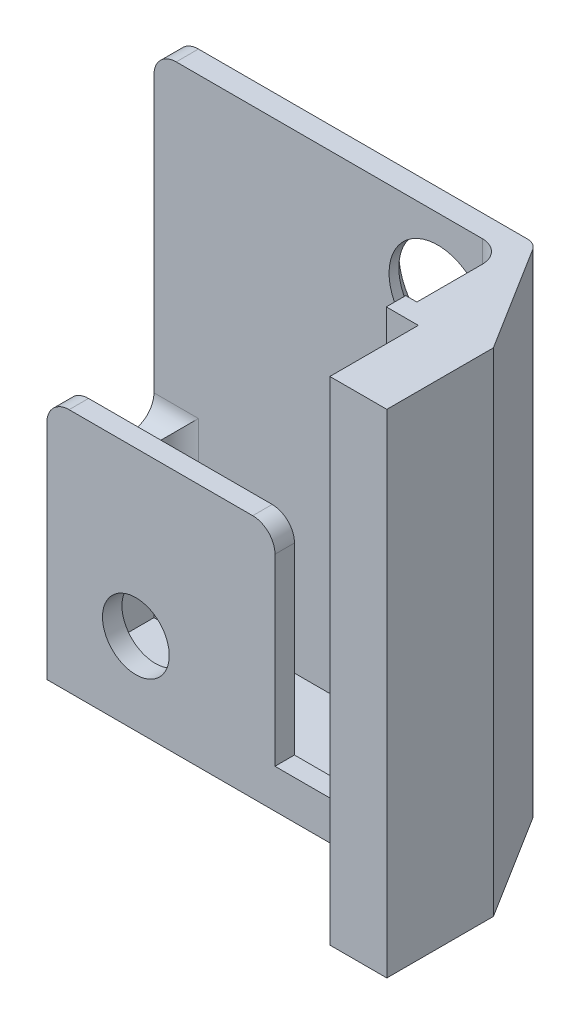
from build123d import *

# Parameters (mm, degrees)
BOSS_EXTRUDE1_DEPTH                             = 15.4
CUT_EXTRUDE2_REACH                              = 25.918
SKETCH3_W                                       = 7.5
SKETCH3_H                                       = 11.5
BOSS_EXTRUDE3_REACH                             = 25.918
SKETCH4_W                                       = 0.8
SKETCH4_H                                       = 6.2
SKETCH4_W_2                                     = 2.8
SKETCH4_H_2                                     = 17.7
SKETCH10_W                                      = 4
SKETCH10_H                                      = 0.7
CUT_EXTRUDE4_DEPTH                              = 16.3
BOSS_EXTRUDE4_DEPTH                             = 0.8
CSK_FOR_M2_FLAT_HEAD_MACHINE_SCREW3_D           = 2.4
CSK_FOR_M2_FLAT_HEAD_MACHINE_SCREW3_CSINK_D     = 4.4
CSK_FOR_M2_FLAT_HEAD_MACHINE_SCREW3_CSINK_ANGLE = 90
MOVE_FACE1_BY                                   = 0.6
SKETCH14_W                                      = 8.2
SKETCH14_H                                      = 8.3
CUT_EXTRUDE6_DEPTH                              = 0.7
SKETCH3_2_W                                     = 7.5
SKETCH3_2_H                                     = 11.5
BOSS_EXTRUDE6_DEPTH                             = 0.8
FILLET3_R                                       = 0.8
CHAMFER1_SIZE                                   = 2.5
CHAMFER1_SIZE2                                  = 4
SKETCH12_W                                      = 2.0475
SKETCH12_H                                      = 3.18
BOSS_EXTRUDE5_DEPTH                             = 17.7
FILLET5_R                                       = 0.5
SKETCH11_R                                      = 1.75
CUT_EXTRUDE5_DEPTH                              = 25.492262043
CUT_EXTRUDE5_DIRECTION_2_REACH                  = 26.492


with BuildPart() as part:
    # Sketch2 → Boss-Extrude1 (new body)
    with BuildSketch(Plane(origin=(0, 0, 0), x_dir=(0, 0, -1), z_dir=(1, 0, 0))):
        Polygon((0, 0), (-4.65, 0), (-4.65, 17.7), (-3.85, 17.7), (-3.85, 0.8), (-0.7, 0.8), (-0.7, 17.7), (0, 17.7), align=None)
    extrude(amount=BOSS_EXTRUDE1_DEPTH)

    # Sketch3 → Cut-Extrude2 (cut, up to next)
    with BuildSketch(Plane.XY.offset(4.65), mode=Mode.PRIVATE) as cut_extrude2_sk1:
        with Locations((3.75, 11.95)):
            Rectangle(SKETCH3_W, SKETCH3_H)
    cut_extrude2_tool1 = extrude(cut_extrude2_sk1.sketch, amount=-CUT_EXTRUDE2_REACH, mode=Mode.PRIVATE) & part.part
    add(cut_extrude2_tool1.solids().sort_by_distance((3.75, 11.95, 4.65))[0], mode=Mode.SUBTRACT)

    # Sketch4 → Boss-Extrude3 (add, up to next)
    with BuildSketch(Plane.XY.offset(4.65), mode=Mode.PRIVATE) as boss_extrude3_sk1:
        with Locations((0.4, 3.1)):
            Rectangle(SKETCH4_W, SKETCH4_H)
    boss_extrude3_tool1 = extrude(boss_extrude3_sk1.sketch, amount=-BOSS_EXTRUDE3_REACH, mode=Mode.PRIVATE) - part.part
    # Sketch4 → Boss-Extrude3 (add, up to next)
    with BuildSketch(Plane.XY.offset(4.65), mode=Mode.PRIVATE) as boss_extrude3_sk2:
        with Locations((14, 8.85)):
            Rectangle(SKETCH4_W_2, SKETCH4_H_2)
    boss_extrude3_tool2 = extrude(boss_extrude3_sk2.sketch, amount=-BOSS_EXTRUDE3_REACH, mode=Mode.PRIVATE) - part.part
    add(boss_extrude3_tool1.solids().sort_by_distance((0.4, 3.1, 4.65))[0])
    add(boss_extrude3_tool2.solids().sort_by_distance((14, 8.85, 4.65))[0])

    # Sketch10 → Cut-Extrude4 (cut)
    with BuildSketch(Plane(origin=(0, 17.7, 0), x_dir=(1, 0, 0), z_dir=(0, 1, 0))):
        with Locations((10.2, -0.35)):
            Rectangle(SKETCH10_W, SKETCH10_H)
    extrude(amount=-CUT_EXTRUDE4_DEPTH, mode=Mode.SUBTRACT)

    # Sketch6 → Boss-Extrude4 (add)
    with BuildSketch(Plane(origin=(0, 0, 3.85), x_dir=(-1, 0, 0), z_dir=(0, 0, -1))):
        with BuildLine():
            Line((-0.8, 0.8), (-5.05, 0.8))
            Line((-5.05, 0.8), (-5.05, 2.95))
            ThreePointArc((-5.05, 2.95), (-4.508147545, 4.258147545), (-3.2, 4.8))
            Line((-3.2, 4.8), (-0.8, 4.8))
            Line((-0.8, 4.8), (-0.8, 0.8))
        make_face()
    extrude(amount=BOSS_EXTRUDE4_DEPTH)

    # CSK for M2 Flat Head Machine Screw3 (through all)
    with Locations(Plane(origin=(10.2, 14.95, 4.65), x_dir=(0, 1, 0), z_dir=(0, 0, 1))):
        with Locations((0, 0), (-12, 7)):
            CounterSinkHole(CSK_FOR_M2_FLAT_HEAD_MACHINE_SCREW3_D / 2, CSK_FOR_M2_FLAT_HEAD_MACHINE_SCREW3_CSINK_D / 2, counter_sink_angle=CSK_FOR_M2_FLAT_HEAD_MACHINE_SCREW3_CSINK_ANGLE)

    # Move Face1: a face moved inward by 0.6
    extrude(part.faces().sort_by_distance((4.1, 17.7, 0.35))[0], amount=MOVE_FACE1_BY, dir=(0, -1, 0), mode=Mode.SUBTRACT)

    # Sketch14 → Cut-Extrude6 (cut)
    with BuildSketch(Plane(origin=(0, 0, 0), x_dir=(-1, 0, 0), z_dir=(0, 0, -1))):
        with Locations((-4.1, 12.95)):
            Rectangle(SKETCH14_W, SKETCH14_H)
    extrude(amount=-CUT_EXTRUDE6_DEPTH, mode=Mode.SUBTRACT)

    # Sketch3<2> → Boss-Extrude6 (add)
    with BuildSketch(Plane.XY.offset(4.65)):
        with Locations((3.75, 11.95)):
            Rectangle(SKETCH3_2_W, SKETCH3_2_H)
    extrude(amount=-BOSS_EXTRUDE6_DEPTH)

    # Fillet3
    fillet3_edges = [part.edges().sort_by_distance(p)[0] for p in [
        (0.8, 5.5, 3.85),
        (0, 8.8, 0.35),
        (8.2, 8.8, 0.35),
        (0, 17.7, 4.25),
        (0.4, 6.2, 3.85),
        (0.4, 6.2, 0.7),
        (12.6, 9.25, 3.85),
    ]]
    fillet(fillet3_edges, radius=FILLET3_R)

    # Chamfer1
    chamfer1_edges = [part.edges().sort_by_distance(p)[0] for p in [
        (15.4, 8.85, 4.65),
    ]]
    chamfer1_side = [part.faces().sort_by_distance(p)[0] for p in [
        (7.829915164, 8.832514614, 4.65),
    ]]
    chamfer(chamfer1_edges, length=CHAMFER1_SIZE, length2=CHAMFER1_SIZE2, reference=chamfer1_side[0])

    # Sketch12 → Boss-Extrude5 (add)
    with BuildSketch(Plane(origin=(0, 17.7, 0), x_dir=(1, 0, 0), z_dir=(0, 1, 0))):
        with Locations((14.37625, 1.59)):
            Rectangle(SKETCH12_W, SKETCH12_H)
    extrude(amount=-BOSS_EXTRUDE5_DEPTH)

    # Fillet5
    fillet5_edges = [part.edges().sort_by_distance(p)[0] for p in [
        (12.9, 8.85, 4.65),
    ]]
    fillet(fillet5_edges, radius=FILLET5_R)

    # Sketch11 → Cut-Extrude5 (cut)
    with BuildSketch(Plane(origin=(0, 0, 3.85), x_dir=(-1, 0, 0), z_dir=(0, 0, -1))):
        with Locations(Location((-10.2, 14.95, 0), (0, 0, 270))):
            Circle(SKETCH11_R)
    extrude(amount=-CUT_EXTRUDE5_DEPTH, mode=Mode.SUBTRACT)

    # Sketch11 → Cut-Extrude5 direction 2 (cut, up to next)
    with BuildSketch(Plane(origin=(0, 0, 3.85), x_dir=(-1, 0, 0), z_dir=(0, 0, -1)), mode=Mode.PRIVATE) as cut_extrude5_direction_2_sk1:
        with Locations(Location((-10.2, 14.95, 0), (0, 0, 270))):
            Circle(SKETCH11_R)
    cut_extrude5_direction_2_tool1 = extrude(cut_extrude5_direction_2_sk1.sketch, amount=CUT_EXTRUDE5_DIRECTION_2_REACH, mode=Mode.PRIVATE) & part.part
    add(cut_extrude5_direction_2_tool1.solids().sort_by_distance((10.2, 14.95, 3.85))[0], mode=Mode.SUBTRACT)


with BuildPart() as body_2:
    # Mirror1: mirrored copy
    add(part.part.mirror(Plane(origin=(13.3525, 0, -3.18), x_dir=(1, 0, 0), z_dir=(0, 0, -1))))


solid = body_2.part
